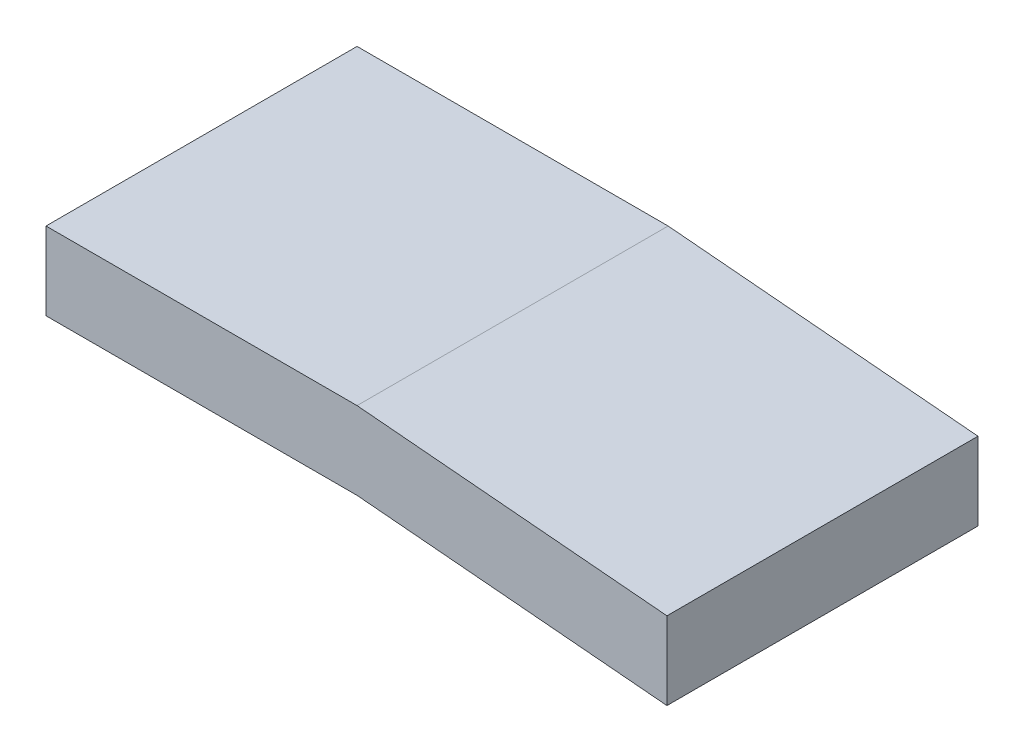
from build123d import *

# Parameters (mm, degrees)
BOSS_EXTRUDE1_DEPTH = 50.8


with BuildPart() as part:
    # Sketch1 → Boss-Extrude1 (new body)
    with BuildSketch(Plane.XY):
        Polygon((0, 0), (0, 12.7), (50.8, 12.7), (101.406690663, 8.272488268), (101.406690663, -4.427511732), (50.8, 0), align=None)
    extrude(amount=BOSS_EXTRUDE1_DEPTH)


solid = part.part
